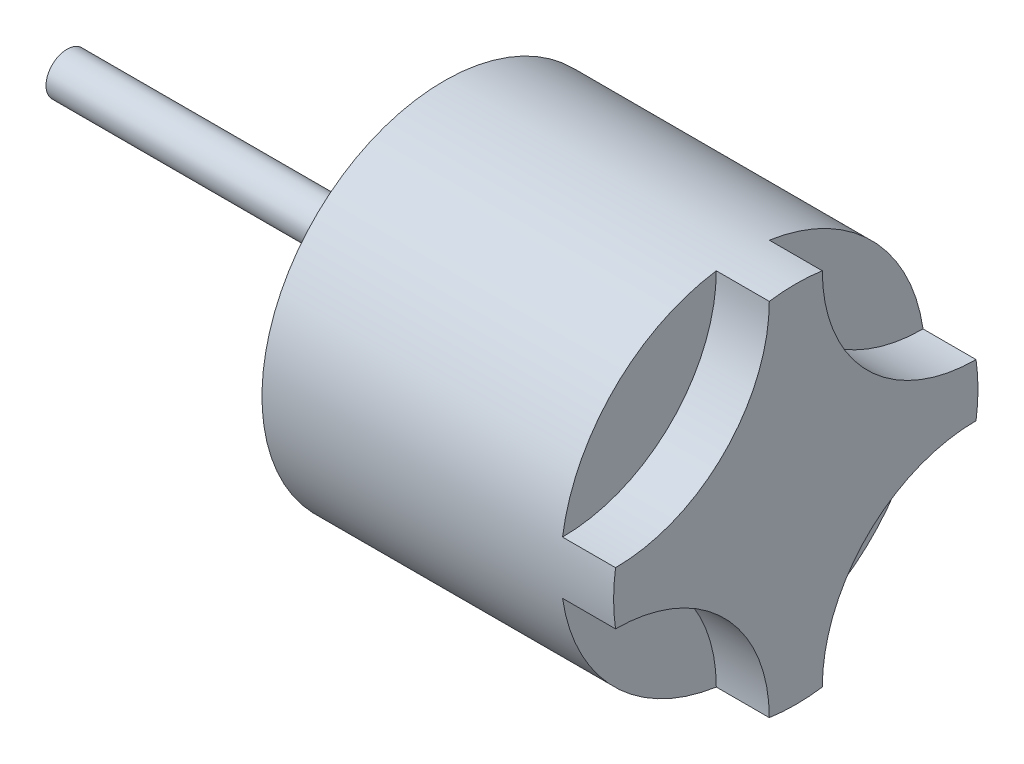
from build123d import *

# Parameters (mm, degrees)
SKETCH1_R            = 13.75
BOSS_EXTRUDE1_DEPTH  = 30
SKETCH2_R            = 1.585
BOSS_EXTRUDE2_DEPTH  = 25
CHAMFER1_SIZE        = 6
CHAMFER1_SIZE2       = 3.464101615
CUT_EXTRUDE1_START   = -4
CUT_EXTRUDE1_DEPTH   = 4
MIRROR2_START        = -4
MIRROR2_COPY_1_DEPTH = 4


with BuildPart() as part:
    # Sketch1 → Boss-Extrude1 (new body)
    with BuildSketch(Plane(origin=(0, 0, 0), x_dir=(0, 0, -1), z_dir=(1, 0, 0))):
        Circle(SKETCH1_R)
    extrude(amount=BOSS_EXTRUDE1_DEPTH)

    # Sketch2 → Boss-Extrude2 (add)
    with BuildSketch(Plane.ZY):
        with Locations(Location((0, 0, 0), (0, 0, 180))):
            Circle(SKETCH2_R)
    extrude(amount=BOSS_EXTRUDE2_DEPTH)

    # Chamfer1
    chamfer1_edges = [part.edges().sort_by_distance(p)[0] for p in [
        (0, 0, 13.75),
    ]]
    chamfer1_side = [part.faces().sort_by_distance(p)[0] for p in [
        (0, 0, 13.36109127),
    ]]
    chamfer(chamfer1_edges, length=CHAMFER1_SIZE, length2=CHAMFER1_SIZE2, reference=chamfer1_side[0])

    # Sketch3 → Cut-Extrude1 (cut)
    with BuildSketch(Plane(origin=(30, 0, 0), x_dir=(0, 0, -1), z_dir=(1, 0, 0)).offset(CUT_EXTRUDE1_START)):
        with BuildLine():
            ThreePointArc((-2, 13.60376786), (-5.398664919, 5.398664919), (-13.60376786, 2))
            ThreePointArc((-13.60376786, 2), (-9.722718241, 9.722718241), (-2, 13.60376786))
        make_face()
    cut_extrude1 = extrude(amount=CUT_EXTRUDE1_DEPTH, mode=Mode.SUBTRACT)

    # Mirror1: Cut-Extrude1 across plane
    add(cut_extrude1.mirror(Plane.XY), mode=Mode.SUBTRACT)

    # Mirror2: Cut-Extrude1 across plane
    add(cut_extrude1.mirror(Plane.ZX), mode=Mode.SUBTRACT)

    # Mirror2 copy 1 sketch → Mirror2 copy 1 (cut)
    with BuildSketch(Plane(origin=(30, 0, 0), x_dir=(0, 0, 1), z_dir=(1, 0, 0)).offset(MIRROR2_START)):
        with BuildLine():
            ThreePointArc((-2, 13.60376786), (-5.398664919, 5.398664919), (-13.60376786, 2))
            ThreePointArc((-13.60376786, 2), (-9.722718241, 9.722718241), (-2, 13.60376786))
        make_face()
    extrude(amount=MIRROR2_COPY_1_DEPTH, mode=Mode.SUBTRACT)


solid = part.part
